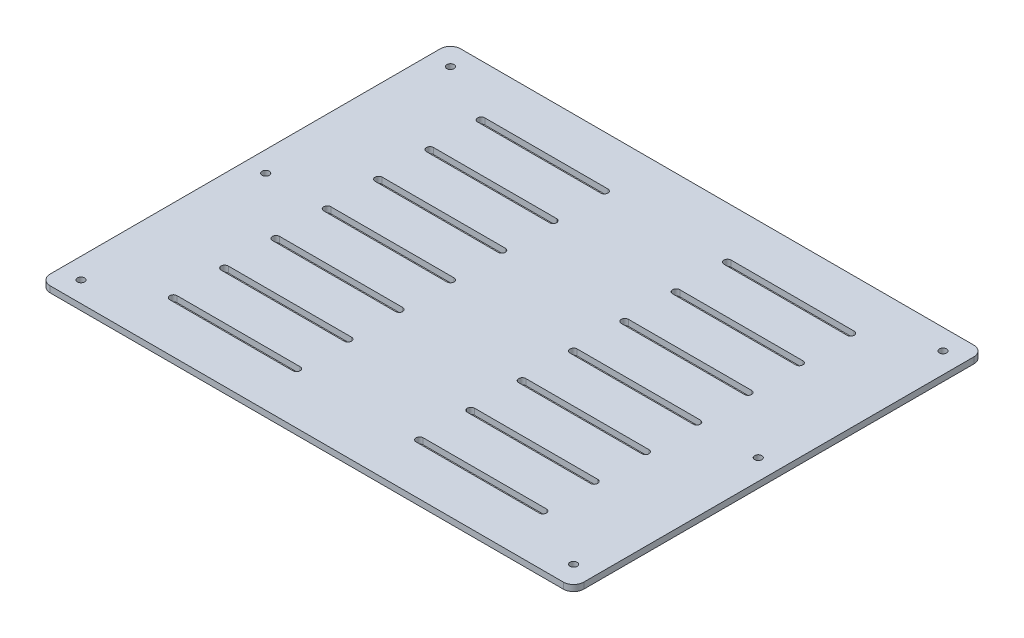
from build123d import *

# Parameters (mm, degrees)
SKETCH_1_W          = 260
SKETCH_1_H          = 200
EXTRUDE_1_DEPTH     = 3
FILLET_1_R          = 5
SKETCH_2_R          = 1.75
CUT_EXTRUDE_1_DEPTH = 10
CUT_EXTRUDE_2_DEPTH = 10


with BuildPart() as part:
    # 草图1 → 凸台-拉伸1 (new body)
    with BuildSketch(Plane(origin=(0, 0, 0), x_dir=(1, 0, 0), z_dir=(0, 1, 0))):
        Rectangle(SKETCH_1_W, SKETCH_1_H)
    extrude(amount=EXTRUDE_1_DEPTH)

    # 圆角1
    fillet_1_edges = [part.edges().sort_by_distance(p)[0] for p in [
        (130, 1.5, 100),
        (-130, 1.5, 100),
        (-130, 1.5, -100),
        (130, 1.5, -100),
    ]]
    fillet(fillet_1_edges, radius=FILLET_1_R)

    # 草图2 → 切除-拉伸1 (cut)
    with BuildSketch(Plane.XZ):
        with Locations(Location((120, 90, 0), (0, 0, 270))):
            Circle(SKETCH_2_R)
        with Locations(Location((120, -90, 0), (0, 0, 270))):
            Circle(SKETCH_2_R)
        with Locations(Location((-120, -90, 0), (0, 0, 270))):
            Circle(SKETCH_2_R)
        with Locations(Location((-120, 90, 0), (0, 0, 270))):
            Circle(SKETCH_2_R)
        with Locations(Location((-120, 0, 0), (0, 0, 270))):
            Circle(SKETCH_2_R)
        with Locations(Location((120, 0, 0), (0, 0, 270))):
            Circle(SKETCH_2_R)
    extrude(amount=-CUT_EXTRUDE_1_DEPTH, mode=Mode.SUBTRACT)

    # 草图3 → 切除-拉伸2 (cut)
    with BuildSketch(Plane(origin=(0, 3, 0), x_dir=(1, 0, 0), z_dir=(0, 1, 0))):
        with BuildLine():
            Line((-90, -73.25), (-30, -73.25))
            ThreePointArc((-30, -73.25), (-28.25, -75), (-30, -76.75))
            Line((-30, -76.75), (-90, -76.75))
            ThreePointArc((-90, -76.75), (-91.75, -75), (-90, -73.25))
        make_face()
        with BuildLine():
            Line((-90, -48.25), (-30, -48.25))
            ThreePointArc((-30, -48.25), (-28.25, -50), (-30, -51.75))
            Line((-30, -51.75), (-90, -51.75))
            ThreePointArc((-90, -51.75), (-91.75, -50), (-90, -48.25))
        make_face()
        with BuildLine():
            Line((-90, -23.25), (-30, -23.25))
            ThreePointArc((-30, -23.25), (-28.25, -25), (-30, -26.75))
            Line((-30, -26.75), (-90, -26.75))
            ThreePointArc((-90, -26.75), (-91.75, -25), (-90, -23.25))
        make_face()
        with BuildLine():
            Line((-90, 1.75), (-30, 1.75))
            ThreePointArc((-30, 1.75), (-28.25, 0), (-30, -1.75))
            Line((-30, -1.75), (-90, -1.75))
            ThreePointArc((-90, -1.75), (-91.75, 0), (-90, 1.75))
        make_face()
        with BuildLine():
            Line((-90, 23.25), (-30, 23.25))
            ThreePointArc((-30, 23.25), (-28.25, 25), (-30, 26.75))
            Line((-30, 26.75), (-90, 26.75))
            ThreePointArc((-90, 26.75), (-91.75, 25), (-90, 23.25))
        make_face()
        with BuildLine():
            Line((-90, 48.25), (-30, 48.25))
            ThreePointArc((-30, 48.25), (-28.25, 50), (-30, 51.75))
            Line((-30, 51.75), (-90, 51.75))
            ThreePointArc((-90, 51.75), (-91.75, 50), (-90, 48.25))
        make_face()
        with BuildLine():
            Line((-90, 73.25), (-30, 73.25))
            ThreePointArc((-30, 73.25), (-28.25, 75), (-30, 76.75))
            Line((-30, 76.75), (-90, 76.75))
            ThreePointArc((-90, 76.75), (-91.75, 75), (-90, 73.25))
        make_face()
        with BuildLine():
            Line((90, 73.25), (30, 73.25))
            ThreePointArc((30, 73.25), (28.25, 75), (30, 76.75))
            Line((30, 76.75), (90, 76.75))
            ThreePointArc((90, 76.75), (91.75, 75), (90, 73.25))
        make_face()
        with BuildLine():
            Line((90, 48.25), (30, 48.25))
            ThreePointArc((30, 48.25), (28.25, 50), (30, 51.75))
            Line((30, 51.75), (90, 51.75))
            ThreePointArc((90, 51.75), (91.75, 50), (90, 48.25))
        make_face()
        with BuildLine():
            Line((90, 23.25), (30, 23.25))
            ThreePointArc((30, 23.25), (28.25, 25), (30, 26.75))
            Line((30, 26.75), (90, 26.75))
            ThreePointArc((90, 26.75), (91.75, 25), (90, 23.25))
        make_face()
        with BuildLine():
            Line((90, 1.75), (30, 1.75))
            ThreePointArc((30, 1.75), (28.25, 0), (30, -1.75))
            Line((30, -1.75), (90, -1.75))
            ThreePointArc((90, -1.75), (91.75, 0), (90, 1.75))
        make_face()
        with BuildLine():
            Line((90, -23.25), (30, -23.25))
            ThreePointArc((30, -23.25), (28.25, -25), (30, -26.75))
            Line((30, -26.75), (90, -26.75))
            ThreePointArc((90, -26.75), (91.75, -25), (90, -23.25))
        make_face()
        with BuildLine():
            Line((90, -48.25), (30, -48.25))
            ThreePointArc((30, -48.25), (28.25, -50), (30, -51.75))
            Line((30, -51.75), (90, -51.75))
            ThreePointArc((90, -51.75), (91.75, -50), (90, -48.25))
        make_face()
        with BuildLine():
            Line((90, -73.25), (30, -73.25))
            ThreePointArc((30, -73.25), (28.25, -75), (30, -76.75))
            Line((30, -76.75), (90, -76.75))
            ThreePointArc((90, -76.75), (91.75, -75), (90, -73.25))
        make_face()
    extrude(amount=-CUT_EXTRUDE_2_DEPTH, mode=Mode.SUBTRACT)


solid = part.part
